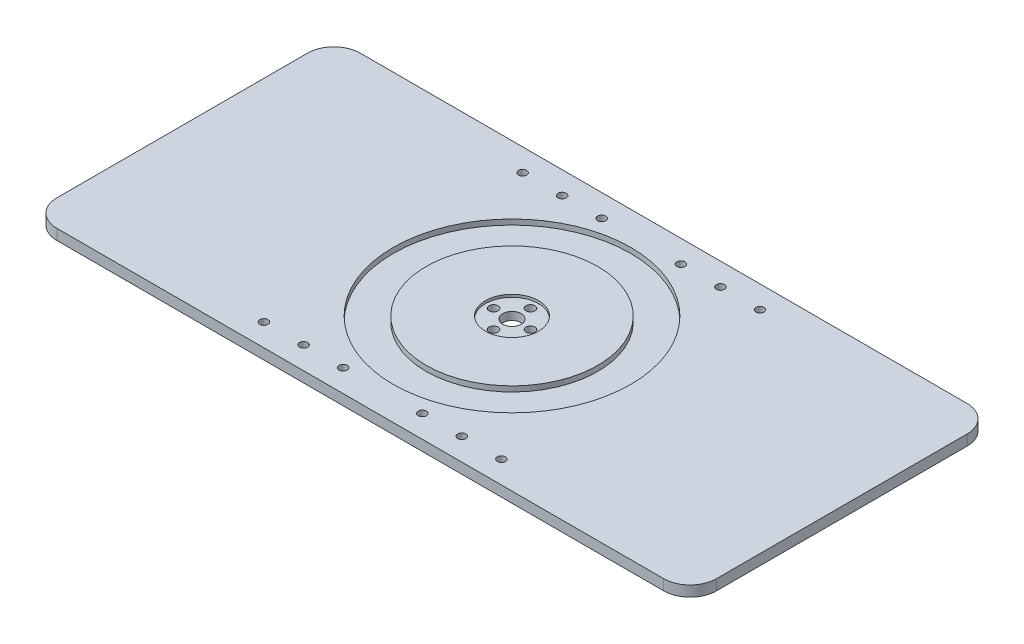
from build123d import *

# Parameters (mm, degrees)
SKETCH_1_W               = 250
SKETCH_1_H               = 115
SKETCH_1_R               = 3.5
SKETCH_1_R_2             = 1.55
EXTRUDE_1_DEPTH          = 4
SKETCH_2_R               = 45
SKETCH_2_R_2             = 32.5
CUT_EXTRUDE_1_DEPTH      = 2
SKETCH_3_R               = 10.05
SKETCH_3_R_2             = 1.7
CUT_EXTRUDE_2_DEPTH      = 1
CUT_EXTRUDE_5_DEPTH      = 20
CUT_EXTRUDE_5_DEPTH_BACK = 20
SKETCH_4_R               = 1.7
FILLET_1_R               = 10


with BuildPart() as part:
    # 草图1 → 凸台-拉伸1 (new body)
    with BuildSketch(Plane(origin=(0, 0, 0), x_dir=(1, 0, 0), z_dir=(0, 1, 0))):
        Rectangle(SKETCH_1_W, SKETCH_1_H)
        with Locations(Location((0, 0, 0), (0, 0, 270))):
            Circle(SKETCH_1_R, mode=Mode.SUBTRACT)
        with Locations(Location((45, 49, 0), (0, 0, 270))):
            Circle(SKETCH_1_R_2, mode=Mode.SUBTRACT)
        with Locations(Location((45, -49, 0), (0, 0, 90))):
            Circle(SKETCH_1_R_2, mode=Mode.SUBTRACT)
        with Locations(Location((-45, -49, 0), (0, 0, 270))):
            Circle(SKETCH_1_R_2, mode=Mode.SUBTRACT)
        with Locations(Location((-45, 49, 0), (0, 0, 90))):
            Circle(SKETCH_1_R_2, mode=Mode.SUBTRACT)
        with Locations(Location((-15, -49, 0), (0, 0, 270))):
            Circle(SKETCH_1_R_2, mode=Mode.SUBTRACT)
        with Locations(Location((15, -49, 0), (0, 0, 90))):
            Circle(SKETCH_1_R_2, mode=Mode.SUBTRACT)
        with Locations(Location((15, 49, 0), (0, 0, 270))):
            Circle(SKETCH_1_R_2, mode=Mode.SUBTRACT)
        with Locations(Location((-15, 49, 0), (0, 0, 90))):
            Circle(SKETCH_1_R_2, mode=Mode.SUBTRACT)
        with Locations(Location((30, 49, 0), (0, 0, 270))):
            Circle(SKETCH_1_R_2, mode=Mode.SUBTRACT)
        with Locations(Location((-30, 49, 0), (0, 0, 270))):
            Circle(SKETCH_1_R_2, mode=Mode.SUBTRACT)
        with Locations(Location((-30, -49, 0), (0, 0, 270))):
            Circle(SKETCH_1_R_2, mode=Mode.SUBTRACT)
        with Locations(Location((30, -49, 0), (0, 0, 270))):
            Circle(SKETCH_1_R_2, mode=Mode.SUBTRACT)
    extrude(amount=EXTRUDE_1_DEPTH)

    # 草图2 → 切除-拉伸1 (cut)
    with BuildSketch(Plane(origin=(0, 4, 0), x_dir=(1, 0, 0), z_dir=(0, 1, 0))):
        with Locations(Location((0, 0, 0), (0, 0, 270))):
            Circle(SKETCH_2_R)
        with Locations(Location((0, 0, 0), (0, 0, 270))):
            Circle(SKETCH_2_R_2, mode=Mode.SUBTRACT)
    extrude(amount=-CUT_EXTRUDE_1_DEPTH, mode=Mode.SUBTRACT)

    # 草图3 → 切除-拉伸2 (cut)
    with BuildSketch(Plane(origin=(0, 4, 0), x_dir=(1, 0, 0), z_dir=(0, 1, 0))):
        with Locations(Location((0, 0, 0), (0, 0, 270))):
            Circle(SKETCH_3_R)
        with Locations(Location((0, 7, 0), (0, 0, 270))):
            Circle(SKETCH_3_R_2, mode=Mode.SUBTRACT)
        with Locations(Location((7, 0, 0), (0, 0, 270))):
            Circle(SKETCH_3_R_2, mode=Mode.SUBTRACT)
        with Locations(Location((0, -7, 0), (0, 0, 270))):
            Circle(SKETCH_3_R_2, mode=Mode.SUBTRACT)
        with Locations(Location((-7, 0, 0), (0, 0, 270))):
            Circle(SKETCH_3_R_2, mode=Mode.SUBTRACT)
    extrude(amount=-CUT_EXTRUDE_2_DEPTH, mode=Mode.SUBTRACT)

    # 草图4 → 切除-拉伸5 (cut, two sides: drawn at the far end of the back side and taken through both)
    with BuildSketch(Plane(origin=(0, 3, 0), x_dir=(1, 0, 0), z_dir=(0, 1, 0)).offset(-CUT_EXTRUDE_5_DEPTH_BACK)):
        with Locations(Location((7, 0, 0), (0, 0, 90))):
            Circle(SKETCH_4_R)
        with Locations(Location((0, 7, 0), (0, 0, 90))):
            Circle(SKETCH_4_R)
        with Locations(Location((0, -7, 0), (0, 0, 90))):
            Circle(SKETCH_4_R)
        with Locations(Location((-7, 0, 0), (0, 0, 90))):
            Circle(SKETCH_4_R)
    extrude(amount=CUT_EXTRUDE_5_DEPTH + CUT_EXTRUDE_5_DEPTH_BACK, mode=Mode.SUBTRACT)

    # 圆角1
    fillet_1_edges = [part.edges().sort_by_distance(p)[0] for p in [
        (125, 2, 57.5),
        (-125, 2, 57.5),
        (-125, 2, -57.5),
        (125, 2, -57.5),
    ]]
    fillet(fillet_1_edges, radius=FILLET_1_R)


solid = part.part
